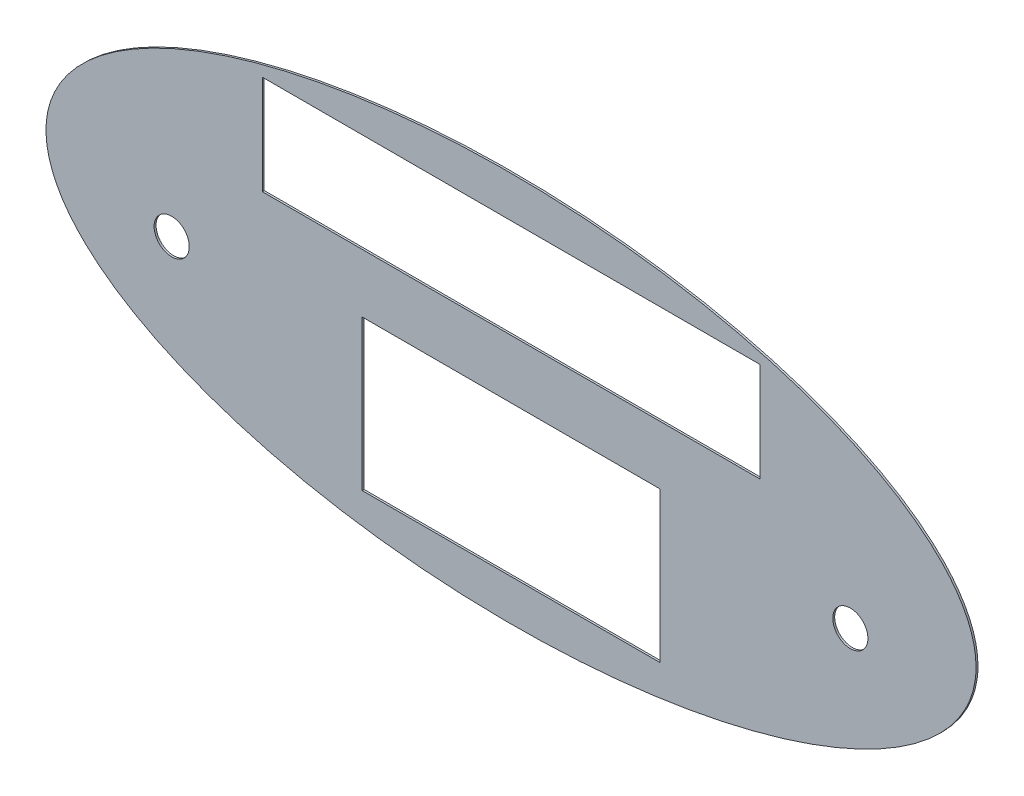
from build123d import *

# Parameters (mm, degrees)
FUSELAGE_FRONT_RX          = 238.17677875
FUSELAGE_FRONT_RY          = 100
FUSELAGE_FRONT_R           = 9
FUSELAGE_FRONT_W           = 254.8
FUSELAGE_FRONT_H           = 50.8
FUSELAGE_FRONT_W_2         = 152.4
FUSELAGE_FRONT_H_2         = 77
FUSELAGE_FRONT_PLATE_DEPTH = 1


with BuildPart() as part:
    # fuselage_front → fuselage_front_plate (new body)
    with BuildSketch(Plane.XY):
        with Locations(Location((0, 1.9), (0, 0, 0))):
            Ellipse(FUSELAGE_FRONT_RX, FUSELAGE_FRONT_RY)
        with Locations((173.785, -13.1)):
            Circle(FUSELAGE_FRONT_R, mode=Mode.SUBTRACT)
        with Locations(Location((-173.785, -13.1, 0), (0, 0, 180))):
            Circle(FUSELAGE_FRONT_R, mode=Mode.SUBTRACT)
        with Locations((0, 55.4)):
            Rectangle(FUSELAGE_FRONT_W, FUSELAGE_FRONT_H, mode=Mode.SUBTRACT)
        with Locations((0, -38.5)):
            Rectangle(FUSELAGE_FRONT_W_2, FUSELAGE_FRONT_H_2, mode=Mode.SUBTRACT)
    extrude(amount=FUSELAGE_FRONT_PLATE_DEPTH)


solid = part.part
